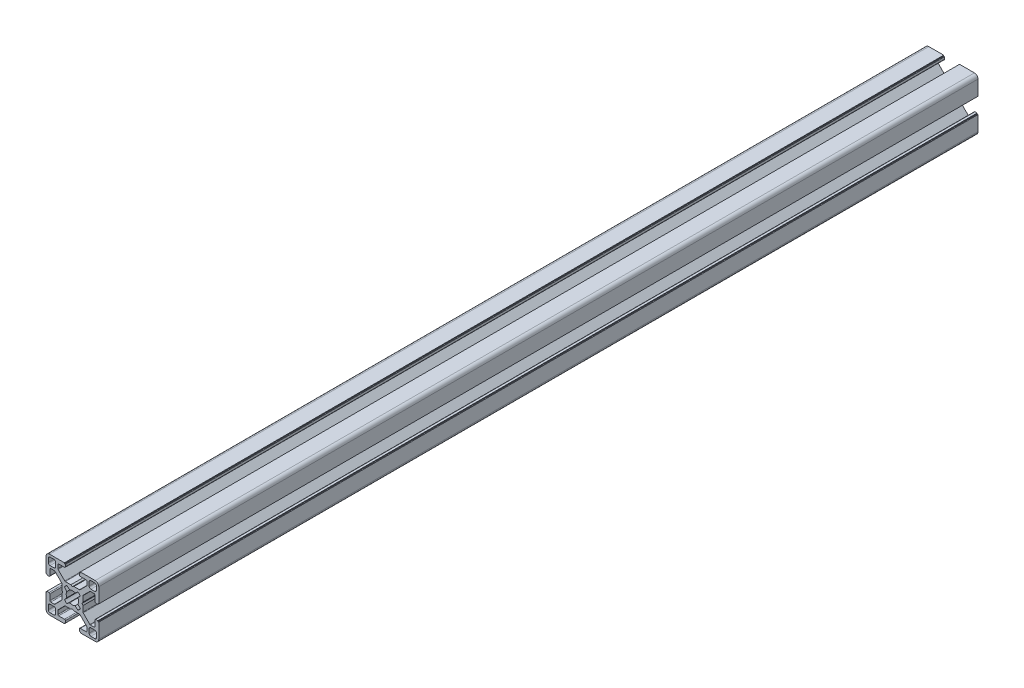
from build123d import *

# Parameters (mm, degrees)
BOSS_EXTRUDE1_DEPTH = 250
CIRPATTERN1_COUNT   = 4


with BuildPart() as part:
    # Sketch3 → Boss-Extrude1 (new, symmetric)
    with BuildSketch(Plane.XY):
        with BuildLine():
            Line((-4.503841895, 3.156803476), (-3.14772708, 1.530298739))
            ThreePointArc((-3.14772708, 1.530298739), (-3.410794979, 0.785160882), (-3.5, 0))
            Line((-3.5, 0), (-5.5, 0))
            Line((-5.5, 0), (-6, 0.866025404))
            Line((-6, 0.866025404), (-6, 3.996841995))
            ThreePointArc((-6, 3.996841995), (-6.038060234, 4.188183711), (-6.146446609, 4.350395385))
            Line((-6.146446609, 4.350395385), (-9.917104615, 8.121053391))
            ThreePointArc((-9.917104615, 8.121053391), (-10.079316289, 8.229439766), (-10.270658005, 8.2675))
            Line((-10.270658005, 8.2675), (-12.29, 8.2675))
            ThreePointArc((-12.29, 8.2675), (-12.643553391, 8.121053391), (-12.79, 7.7675))
            Line((-12.79, 7.7675), (-12.79, 4.5))
            ThreePointArc((-12.79, 4.5), (-12.936446609, 4.146446609), (-13.29, 4))
            Line((-13.29, 4), (-14.5, 4))
            Line((-14.5, 4), (-14.5, 4.5))
            Line((-14.5, 4.5), (-15, 4.5))
            Line((-15, 4.5), (-15, 12.968))
            ThreePointArc((-15, 12.968), (-14.404840979, 14.404840979), (-12.968, 15))
            Line((-12.968, 15), (-4.5, 15))
            Line((-4.5, 15), (-4.5, 14.5))
            Line((-4.5, 14.5), (-4, 14.5))
            Line((-4, 14.5), (-4, 13.29))
            ThreePointArc((-4, 13.29), (-4.146446609, 12.936446609), (-4.5, 12.79))
            Line((-4.5, 12.79), (-7.7675, 12.79))
            ThreePointArc((-7.7675, 12.79), (-8.121053391, 12.643553391), (-8.2675, 12.29))
            Line((-8.2675, 12.29), (-8.2675, 10.270658005))
            ThreePointArc((-8.2675, 10.270658005), (-8.229439766, 10.079316289), (-8.121053391, 9.917104615))
            Line((-8.121053391, 9.917104615), (-4.350395385, 6.146446609))
            ThreePointArc((-4.350395385, 6.146446609), (-4.188183711, 6.038060234), (-3.996841995, 6))
            Line((-3.996841995, 6), (-0.866025404, 6))
            Line((-0.866025404, 6), (0, 5.5))
            Line((0, 5.5), (0, 3.5))
            ThreePointArc((0, 3.5), (-0.785160882, 3.410794979), (-1.530298739, 3.14772708))
            Line((-1.530298739, 3.14772708), (-3.156803476, 4.503841895))
            ThreePointArc((-3.156803476, 4.503841895), (-3.889087297, 3.889087297), (-4.503841895, 3.156803476))
        make_face()
        with BuildLine():
            Line((-12.705, 9.5135), (-10.5135, 9.5135))
            ThreePointArc((-10.5135, 9.5135), (-9.806393219, 9.806393219), (-9.5135, 10.5135))
            Line((-9.5135, 10.5135), (-9.5135, 12.705))
            ThreePointArc((-9.5135, 12.705), (-9.806393219, 13.412106781), (-10.5135, 13.705))
            Line((-10.5135, 13.705), (-12.705, 13.705))
            ThreePointArc((-12.705, 13.705), (-13.412106781, 13.412106781), (-13.705, 12.705))
            Line((-13.705, 12.705), (-13.705, 10.5135))
            ThreePointArc((-13.705, 10.5135), (-13.412106781, 9.806393219), (-12.705, 9.5135))
        make_face(mode=Mode.SUBTRACT)
    boss_extrude1 = extrude(amount=BOSS_EXTRUDE1_DEPTH, both=True)

    # CirPattern1: Boss-Extrude1 ×4 about axis
    cirpattern1_axis = Axis((0, 0, 0), (0, 0, 1))
    for i in range(1, CIRPATTERN1_COUNT):
        add(boss_extrude1.rotate(cirpattern1_axis, i * 360 / CIRPATTERN1_COUNT))


solid = part.part
